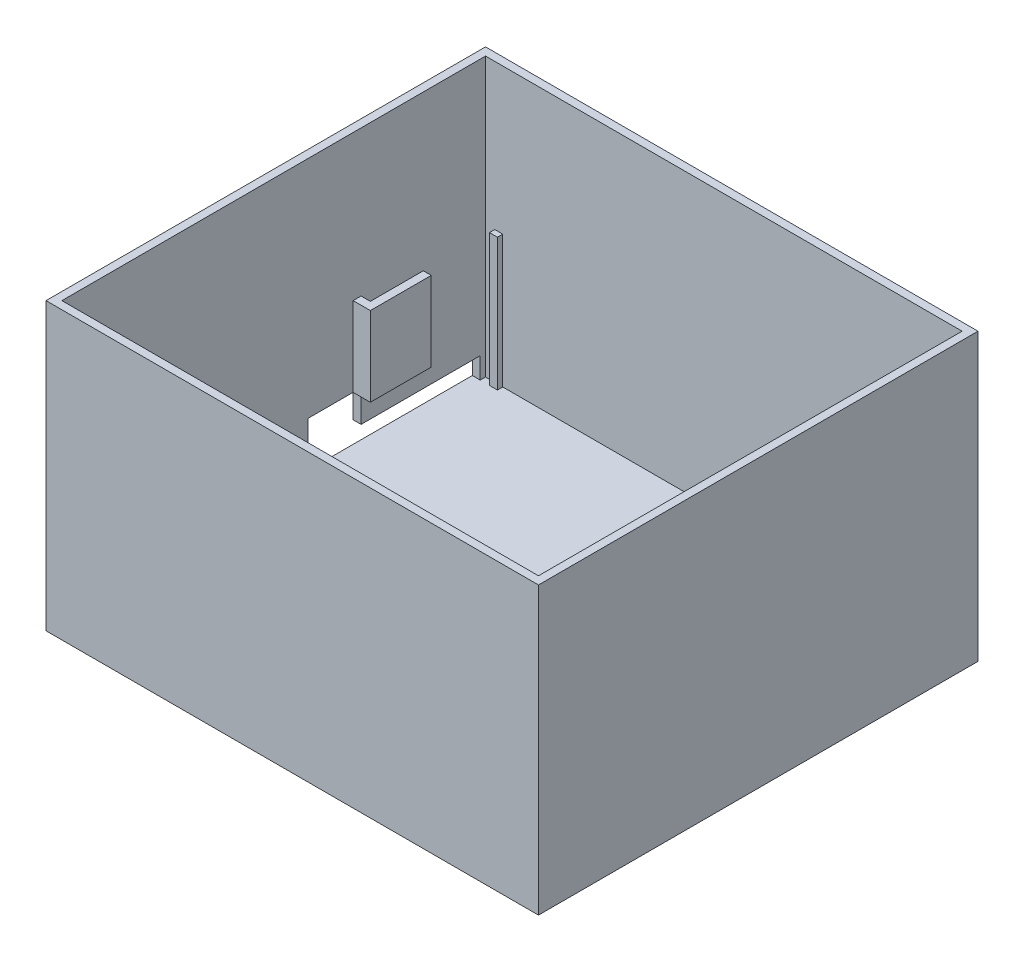
from build123d import *

# Parameters (mm, degrees)
SKETCH1_W            = 186
SKETCH1_H            = 166
BOSS_EXTRUDE6_DEPTH  = 3
SKETCH9_W            = 183
SKETCH9_H            = 3
BOSS_EXTRUDE7_DEPTH  = 105
SKETCH8_W            = 3
SKETCH8_H            = 163
BOSS_EXTRUDE8_DEPTH  = 105
SKETCH7_W            = 186
SKETCH7_H            = 3
BOSS_EXTRUDE9_DEPTH  = 105
SKETCH11_W           = 3
SKETCH11_H           = 160
BOSS_EXTRUDE10_DEPTH = 105
SKETCH12_W           = 180
SKETCH12_H           = 3
BOSS_EXTRUDE11_DEPTH = 20
SKETCH13_W           = 45
SKETCH13_H           = 8
CUT_EXTRUDE5_DEPTH   = 3
SKETCH20_W           = 3
SKETCH20_H           = 2
BOSS_EXTRUDE12_DEPTH = 50
SKETCH18_W           = 20
SKETCH18_H           = 20
CUT_EXTRUDE6_DEPTH   = 3
SKETCH22_W           = 3
SKETCH22_H           = 30
BOSS_EXTRUDE13_DEPTH = 6.5
SKETCH23_W           = 3
SKETCH23_H           = 30
BOSS_EXTRUDE15_DEPTH = 20


with BuildPart() as part:
    # Sketch1 → Boss-Extrude6 (new body)
    with BuildSketch(Plane(origin=(0, 0, 0), x_dir=(1, 0, 0), z_dir=(0, 1, 0))):
        with Locations((3.75, -30.125)):
            Rectangle(SKETCH1_W, SKETCH1_H)
    extrude(amount=BOSS_EXTRUDE6_DEPTH)

    # Sketch9 → Boss-Extrude7 (add)
    with BuildSketch(Plane(origin=(0, 3, 0), x_dir=(1, 0, 0), z_dir=(0, 1, 0))):
        with Locations((2.25, -111.625)):
            Rectangle(SKETCH9_W, SKETCH9_H)
    extrude(amount=BOSS_EXTRUDE7_DEPTH)

    # Sketch8 → Boss-Extrude8 (add)
    with BuildSketch(Plane(origin=(0, 3, 0), x_dir=(1, 0, 0), z_dir=(0, 1, 0))):
        with Locations((95.25, -31.625)):
            Rectangle(SKETCH8_W, SKETCH8_H)
    extrude(amount=BOSS_EXTRUDE8_DEPTH)

    # Sketch7 → Boss-Extrude9 (add)
    with BuildSketch(Plane(origin=(0, 3, 0), x_dir=(1, 0, 0), z_dir=(0, 1, 0))):
        with Locations((3.75, 51.375)):
            Rectangle(SKETCH7_W, SKETCH7_H)
    extrude(amount=BOSS_EXTRUDE9_DEPTH)

    # Sketch11 → Boss-Extrude10 (add)
    with BuildSketch(Plane(origin=(0, 3, 0), x_dir=(1, 0, 0), z_dir=(0, 1, 0))):
        with Locations((-87.75, -30.125)):
            Rectangle(SKETCH11_W, SKETCH11_H)
    extrude(amount=BOSS_EXTRUDE10_DEPTH)

    # Sketch12 → Boss-Extrude11 (add)
    with BuildSketch(Plane(origin=(0, 3, 0), x_dir=(1, 0, 0), z_dir=(0, 1, 0))):
        with Locations((3.75, -52.625)):
            Rectangle(SKETCH12_W, SKETCH12_H)
    extrude(amount=BOSS_EXTRUDE11_DEPTH)

    # Sketch13 → Cut-Extrude5 (cut)
    with BuildSketch(Plane(origin=(-86.25, 0, 0), x_dir=(0, 0, -1), z_dir=(1, 0, 0))):
        with Locations((25.375, 7)):
            Rectangle(SKETCH13_W, SKETCH13_H)
    extrude(amount=-CUT_EXTRUDE5_DEPTH, mode=Mode.SUBTRACT)

    # Sketch20 → Boss-Extrude12 (add)
    with BuildSketch(Plane(origin=(0, 3, 0), x_dir=(1, 0, 0), z_dir=(0, 1, 0))):
        with Locations((-81.25, 48.875)):
            Rectangle(SKETCH20_W, SKETCH20_H)
    extrude(amount=BOSS_EXTRUDE12_DEPTH)

    # Sketch18 → Cut-Extrude6 (cut)
    with BuildSketch(Plane.ZY.offset(89.25)):
        with Locations((7.125, 13)):
            Rectangle(SKETCH18_W, SKETCH18_H)
    extrude(amount=-CUT_EXTRUDE6_DEPTH, mode=Mode.SUBTRACT)

    # Sketch22 → Boss-Extrude13 (add)
    with BuildSketch(Plane(origin=(-86.25, 0, 0), x_dir=(0, 0, -1), z_dir=(1, 0, 0))):
        with Locations((1.375, 38)):
            Rectangle(SKETCH22_W, SKETCH22_H)
    extrude(amount=BOSS_EXTRUDE13_DEPTH)

    # Sketch23 → Boss-Extrude15 (add)
    with BuildSketch(Plane(origin=(0, 0, -2.875), x_dir=(-1, 0, 0), z_dir=(0, 0, -1))):
        with Locations((81.25, 38)):
            Rectangle(SKETCH23_W, SKETCH23_H)
    extrude(amount=BOSS_EXTRUDE15_DEPTH)


solid = part.part
